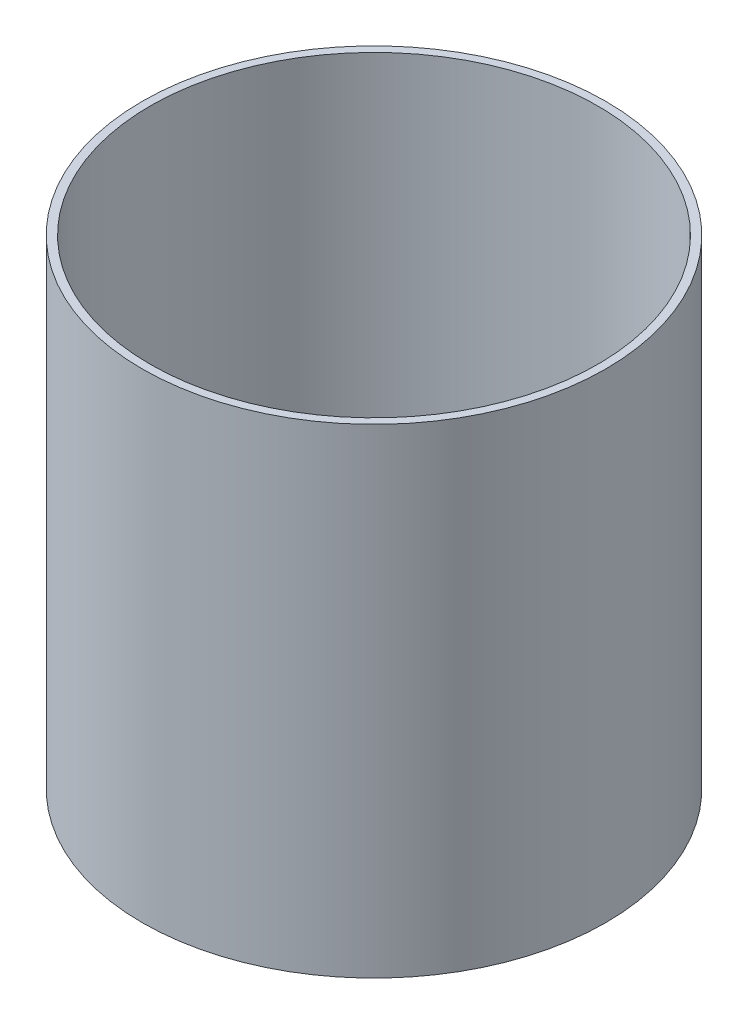
from build123d import *

# Parameters (mm, degrees)
SKETCH1_R           = 145
SKETCH1_R_2         = 140
BOSS_EXTRUDE1_DEPTH = 300


with BuildPart() as part:
    # Sketch1 → Boss-Extrude1 (new body)
    with BuildSketch(Plane(origin=(0, 0, 0), x_dir=(1, 0, 0), z_dir=(0, 1, 0))):
        with Locations(Location((0, 0, 0), (0, 0, 270))):
            Circle(SKETCH1_R)
        with Locations(Location((0, 0, 0), (0, 0, 270))):
            Circle(SKETCH1_R_2, mode=Mode.SUBTRACT)
    extrude(amount=BOSS_EXTRUDE1_DEPTH)


solid = part.part
